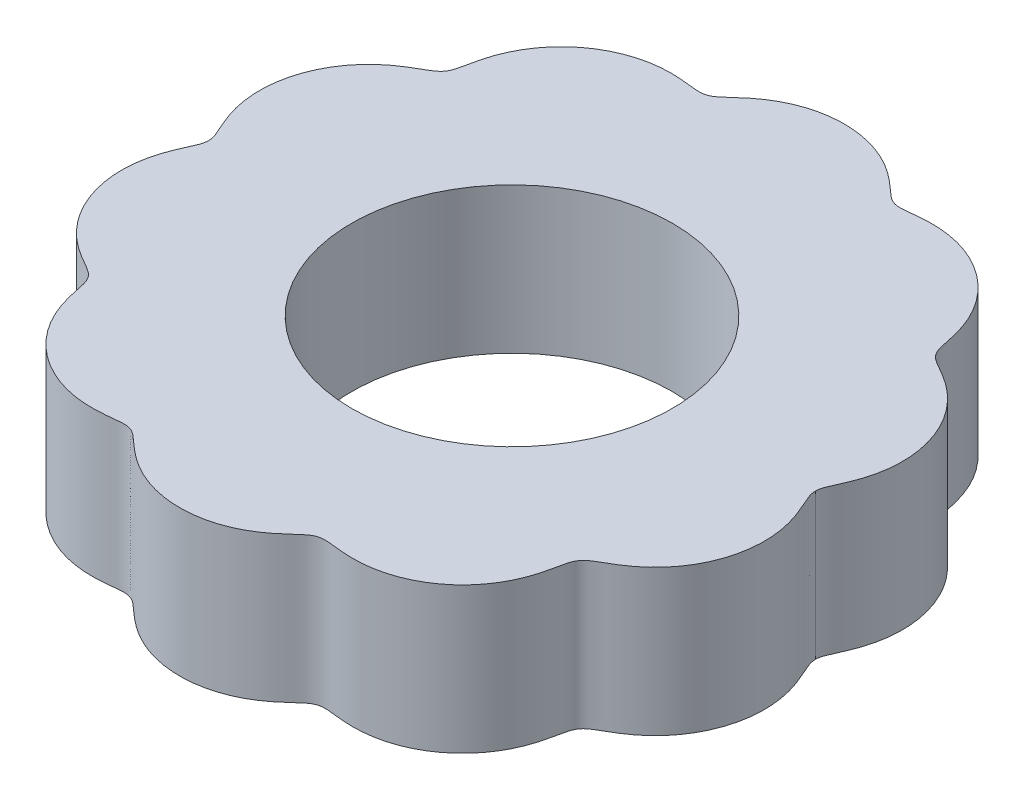
from build123d import *

# Parameters (mm, degrees)
SKETCH4_R           = 11
BOSS_EXTRUDE3_DEPTH = 10


with BuildPart() as part:
    # Sketch4 → Boss-Extrude3 (new body)
    with BuildSketch(Plane(origin=(0, 0, 0), x_dir=(1, 0, 0), z_dir=(0, 1, 0))):
        with BuildLine():
            add(Edge.make_bspline(
                [(20.806767993, 0), (20.806767992, -0.015142642), (20.807445977, -0.045422112), (20.810496789, -0.10115118), (20.818474451, -0.177358342), (20.83196295, -0.25952089), (20.852588669, -0.34957385), (20.881526777, -0.451500736), (20.919202598, -0.56238234), (20.965829746, -0.684471512), (21.021382099, -0.817888402), (21.102486518, -1.002051142), (21.209435272, -1.236797537), (21.332558792, -1.51142886), (21.465859858, -1.829729038), (21.588559663, -2.15344073), (21.726181711, -2.565452201), (21.908798732, -3.238114345), (22.060487753, -4.186995962), (22.062955738, -5.413011735), (21.806140679, -6.790277563), (21.299824893, -8.096574008), (20.653205452, -9.138151822), (19.968405913, -9.93188531), (19.321641716, -10.516512385), (18.764192799, -10.935552874), (18.275573901, -11.243612045), (17.877857941, -11.470188557), (17.58383847, -11.637582478), (17.395243097, -11.748879474), (17.191907746, -11.880467667), (16.9884628, -12.038327646), (16.820704227, -12.225805478), (16.703106516, -12.438127404), (16.619601686, -12.655420914), (16.556807412, -12.879274843), (16.486128091, -13.195065156), (16.415374921, -13.551956094), (16.33394163, -13.924878293), (16.21218572, -14.396135927), (16.003567346, -15.061092057), (15.623583231, -15.9435753), (14.969345736, -16.980539116), (14.014651146, -18.005918981), (12.887118515, -18.837520645), (11.625559025, -19.446817447), (10.441687654, -19.765802906), (9.399473673, -19.877512519), (8.629663552, -19.868490698), (8.137594475, -19.832235001), (7.748205601, -19.791233132), (7.460109348, -19.758351647), (7.194761064, -19.731275204), (6.951167825, -19.71729447), (6.71030071, -19.724425623), (6.469529333, -19.763597877), (6.212608085, -19.86670772), (5.958747857, -20.039183623), (5.712091463, -20.247820559), (5.464194594, -20.474562524), (5.211485952, -20.704954479), (4.948891935, -20.933859455), (4.476652089, -21.319166801), (3.902562048, -21.716148536), (3.211323558, -22.09087073), (2.236904454, -22.471745436), (1.220610358, -22.728905987), (0, -22.842385903), (-1.220610359, -22.728905987), (-2.236904455, -22.471745436), (-3.211323558, -22.09087073), (-3.902562049, -21.716148536), (-4.47665209, -21.319166801), (-4.948891935, -20.933859455), (-5.211485952, -20.704954479), (-5.464194596, -20.474562524), (-5.712091461, -20.247820559), (-5.95874786, -20.039183622), (-6.212608082, -19.866707722), (-6.469529339, -19.763597875), (-6.710300702, -19.724425626), (-6.951167843, -19.717294462), (-7.194761023, -19.731275222), (-7.460109435, -19.758351609), (-7.748205475, -19.791233186), (-8.137594693, -19.832234906), (-8.629663215, -19.868490844), (-9.39947424, -19.877512272), (-10.441686788, -19.765803283), (-11.625560343, -19.446816873), (-12.88711666, -18.837521452), (-14.014654092, -18.005917697), (-14.969340575, -16.980541364), (-15.623591902, -15.943571523), (-16.003554131, -15.061097814), (-16.21220595, -14.396127114), (-16.333893427, -13.924899292), (-16.415482712, -13.551909137), (-16.485956353, -13.195139969), (-16.567291077, -12.833401661), (-16.65215369, -12.543679019), (-16.788894172, -12.261204696), (-16.988588086, -12.038273068), (-17.191823515, -11.88050436), (-17.395293933, -11.748857328), (-17.583814365, -11.637592978), (-17.87787294, -11.470182022), (-18.275564225, -11.243616259), (-18.764198274, -10.935550489), (-19.321639325, -10.516513426), (-19.968407324, -9.931884695), (-20.65320454, -9.138152219), (-21.299825473, -8.096573755), (-21.806140325, -6.790277716), (-22.06295599, -5.413011625), (-22.06048758, -4.186996038), (-21.908798835, -3.2381143), (-21.726181656, -2.565452224), (-21.5885597, -2.153440714), (-21.465859831, -1.829729049), (-21.332558811, -1.51142885), (-21.209435261, -1.236797542), (-21.102486525, -1.002051138), (-21.021382097, -0.817888404), (-20.965829747, -0.684471519), (-20.919202598, -0.562382296), (-20.881526775, -0.451500834), (-20.852588668, -0.349573916), (-20.83196296, -0.259520211), (-20.818474444, -0.177358817), (-20.810496739, -0.101154544), (-20.807445948, -0.045424102), (-20.806767993, -0.015142642), (-20.806767993, 0)],
                knots=[0.073154281, 0.073154281, 0.073154281, 0.073154281, 0.073154281, 0.073986106, 0.074817932, 0.075649757, 0.076481583, 0.077853205, 0.079224828, 0.080596451, 0.081968073, 0.08398429, 0.086000507, 0.090032941, 0.094065375, 0.098097808, 0.102180825, 0.106263842, 0.114429875, 0.130760532, 0.147091512, 0.163422735, 0.179754093, 0.196085255, 0.204250612, 0.21241597, 0.220581504, 0.228747037, 0.231314034, 0.23388103, 0.236448027, 0.239015024, 0.242667302, 0.245929484, 0.248129117, 0.25032875, 0.253573044, 0.256817337, 0.263305925, 0.267388702, 0.27147148, 0.279637035, 0.295968276, 0.312299455, 0.3286306, 0.344961885, 0.36129319, 0.377623682, 0.385789548, 0.393955413, 0.397354309, 0.400753204, 0.404152099, 0.407550995, 0.409866146, 0.412181297, 0.415443233, 0.41892697, 0.422718531, 0.426510091, 0.430592992, 0.434675893, 0.438758794, 0.442841694, 0.459171879, 0.467337552, 0.475503225, 0.491834446, 0.508165554, 0.524496775, 0.532662448, 0.540828121, 0.557158306, 0.561241206, 0.565324107, 0.569407008, 0.573489909, 0.577281469, 0.58107303, 0.584556767, 0.587818703, 0.590133854, 0.592449005, 0.595847901, 0.599246796, 0.602645691, 0.606044587, 0.614210452, 0.622376318, 0.63870681, 0.655038115, 0.6713694, 0.687700545, 0.704031724, 0.720362965, 0.72852852, 0.732611298, 0.736694075, 0.743182663, 0.746426956, 0.74967125, 0.754070516, 0.757332698, 0.760984976, 0.763551973, 0.76611897, 0.768685966, 0.771252963, 0.779418496, 0.78758403, 0.795749388, 0.803914745, 0.820245907, 0.836577265, 0.852908488, 0.869239468, 0.885570125, 0.893736158, 0.897819175, 0.901902192, 0.905934625, 0.909967059, 0.913999493, 0.91601571, 0.918031927, 0.919403549, 0.920775172, 0.922146795, 0.923518417, 0.924350243, 0.925182068, 0.926013894, 0.926845719, 0.926845719, 0.926845719, 0.926845719, 0.926845719], degree=4))
            add(Edge.make_bspline(
                [(20.806767993, 0), (20.806767993, 0.015142642), (20.807445977, 0.045422112), (20.810496789, 0.10115118), (20.818474451, 0.177358341), (20.83196295, 0.25952089), (20.852588669, 0.34957385), (20.881526777, 0.451500736), (20.919202598, 0.56238234), (20.965829746, 0.684471511), (21.021382099, 0.817888401), (21.102486518, 1.002051142), (21.209435272, 1.236797536), (21.332558792, 1.511428859), (21.465859858, 1.829729038), (21.588559663, 2.15344073), (21.726181711, 2.5654522), (21.908798732, 3.238114344), (22.060487753, 4.186995962), (22.062955738, 5.413011735), (21.806140679, 6.790277563), (21.299824893, 8.096574008), (20.653205452, 9.138151821), (19.968405913, 9.93188531), (19.321641716, 10.516512385), (18.764192799, 10.935552874), (18.275573901, 11.243612044), (17.877857941, 11.470188556), (17.58383847, 11.637582478), (17.395243097, 11.748879473), (17.191907746, 11.880467667), (16.9884628, 12.038327645), (16.820704227, 12.225805477), (16.703106516, 12.438127403), (16.619601686, 12.655420914), (16.556807412, 12.879274843), (16.486128091, 13.195065156), (16.415374921, 13.551956094), (16.33394163, 13.924878293), (16.21218572, 14.396135926), (16.003567346, 15.061092057), (15.623583231, 15.943575299), (14.969345736, 16.980539115), (14.014651146, 18.00591898), (12.887118515, 18.837520644), (11.625559025, 19.446817447), (10.441687654, 19.765802905), (9.399473673, 19.877512519), (8.629663552, 19.868490698), (8.137594476, 19.832235001), (7.748205601, 19.791233131), (7.460109348, 19.758351647), (7.194761065, 19.731275204), (6.951167825, 19.717294469), (6.71030071, 19.724425623), (6.469529333, 19.763597877), (6.212608086, 19.86670772), (5.958747857, 20.039183623), (5.712091463, 20.247820558), (5.464194595, 20.474562524), (5.211485953, 20.704954479), (4.948891935, 20.933859455), (4.47665209, 21.319166801), (3.902562049, 21.716148536), (3.211323558, 22.09087073), (2.236904454, 22.471745436), (1.220610358, 22.728905987), (0, 22.842385903), (-1.220610358, 22.728905987), (-2.236904454, 22.471745436), (-3.211323558, 22.09087073), (-3.902562049, 21.716148536), (-4.476652089, 21.319166801), (-4.948891935, 20.933859455), (-5.211485952, 20.704954479), (-5.464194596, 20.474562524), (-5.712091461, 20.247820559), (-5.95874786, 20.039183621), (-6.212608082, 19.866707721), (-6.469529339, 19.763597875), (-6.710300701, 19.724425626), (-6.951167843, 19.717294462), (-7.194761023, 19.731275222), (-7.460109435, 19.758351609), (-7.748205475, 19.791233186), (-8.137594692, 19.832234906), (-8.629663215, 19.868490844), (-9.399474239, 19.877512272), (-10.441686788, 19.765803283), (-11.625560342, 19.446816873), (-12.88711666, 18.837521452), (-14.014654092, 18.005917697), (-14.969340574, 16.980541364), (-15.623591901, 15.943571523), (-16.003554131, 15.061097813), (-16.21220595, 14.396127114), (-16.333893427, 13.924899292), (-16.415482712, 13.551909137), (-16.485956353, 13.195139969), (-16.567291077, 12.833401661), (-16.65215369, 12.543679019), (-16.788894172, 12.261204696), (-16.988588086, 12.038273068), (-17.191823514, 11.88050436), (-17.395293933, 11.748857328), (-17.583814365, 11.637592978), (-17.87787294, 11.470182022), (-18.275564225, 11.243616259), (-18.764198274, 10.935550489), (-19.321639325, 10.516513426), (-19.968407324, 9.931884695), (-20.65320454, 9.138152219), (-21.299825473, 8.096573755), (-21.806140325, 6.790277717), (-22.06295599, 5.413011625), (-22.060487579, 4.186996038), (-21.908798835, 3.2381143), (-21.726181655, 2.565452225), (-21.5885597, 2.153440714), (-21.465859831, 1.829729049), (-21.332558811, 1.51142885), (-21.209435261, 1.236797542), (-21.102486525, 1.002051138), (-21.021382097, 0.817888404), (-20.965829747, 0.684471519), (-20.919202598, 0.562382296), (-20.881526775, 0.451500834), (-20.852588668, 0.349573916), (-20.83196296, 0.259520211), (-20.818474444, 0.177358817), (-20.810496739, 0.101154544), (-20.807445948, 0.045424102), (-20.806767993, 0.015142642), (-20.806767993, 0)],
                knots=[0.073154281, 0.073154281, 0.073154281, 0.073154281, 0.073154281, 0.073986106, 0.074817932, 0.075649757, 0.076481583, 0.077853205, 0.079224828, 0.080596451, 0.081968073, 0.08398429, 0.086000507, 0.090032941, 0.094065375, 0.098097808, 0.102180825, 0.106263842, 0.114429875, 0.130760532, 0.147091512, 0.163422735, 0.179754093, 0.196085255, 0.204250612, 0.21241597, 0.220581504, 0.228747037, 0.231314034, 0.23388103, 0.236448027, 0.239015024, 0.242667302, 0.245929484, 0.248129117, 0.25032875, 0.253573044, 0.256817337, 0.263305925, 0.267388702, 0.27147148, 0.279637035, 0.295968276, 0.312299455, 0.3286306, 0.344961885, 0.36129319, 0.377623682, 0.385789548, 0.393955413, 0.397354309, 0.400753204, 0.404152099, 0.407550995, 0.409866146, 0.412181297, 0.415443233, 0.41892697, 0.422718531, 0.426510091, 0.430592992, 0.434675893, 0.438758794, 0.442841694, 0.459171879, 0.467337552, 0.475503225, 0.491834446, 0.508165554, 0.524496775, 0.532662448, 0.540828121, 0.557158306, 0.561241206, 0.565324107, 0.569407008, 0.573489909, 0.577281469, 0.58107303, 0.584556767, 0.587818703, 0.590133854, 0.592449005, 0.595847901, 0.599246796, 0.602645691, 0.606044587, 0.614210452, 0.622376318, 0.63870681, 0.655038115, 0.6713694, 0.687700545, 0.704031724, 0.720362965, 0.72852852, 0.732611298, 0.736694075, 0.743182663, 0.746426956, 0.74967125, 0.754070516, 0.757332698, 0.760984976, 0.763551973, 0.76611897, 0.768685966, 0.771252963, 0.779418496, 0.78758403, 0.795749388, 0.803914745, 0.820245907, 0.836577265, 0.852908488, 0.869239468, 0.885570125, 0.893736158, 0.897819175, 0.901902192, 0.905934625, 0.909967059, 0.913999493, 0.91601571, 0.918031927, 0.919403549, 0.920775172, 0.922146795, 0.923518417, 0.924350243, 0.925182068, 0.926013894, 0.926845719, 0.926845719, 0.926845719, 0.926845719, 0.926845719], degree=4))
        make_face()
        with Locations(Location((0, 0, 0), (0, 0, 270))):
            Circle(SKETCH4_R, mode=Mode.SUBTRACT)
    extrude(amount=BOSS_EXTRUDE3_DEPTH)


solid = part.part
